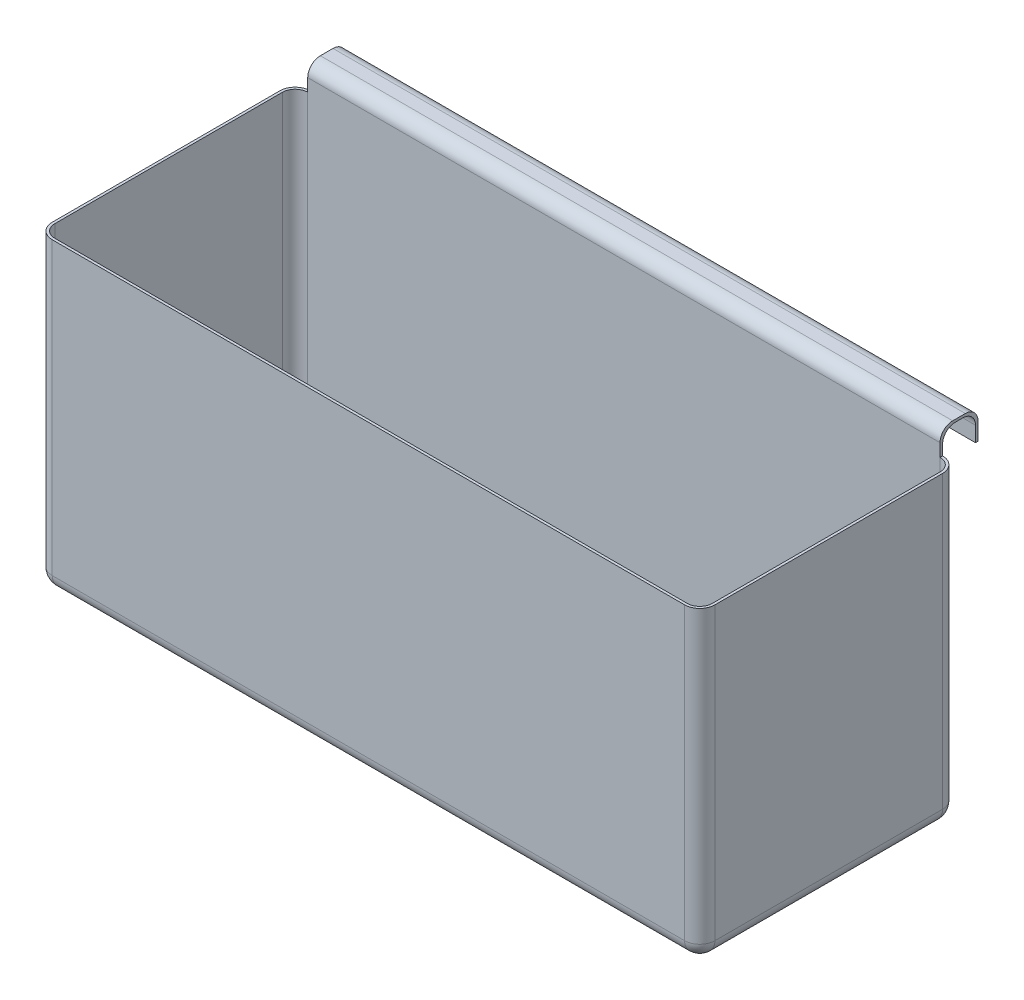
from build123d import *

# Parameters (mm, degrees)
SKETCH1_W           = 260
SKETCH1_H           = 100
BOSS_EXTRUDE1_DEPTH = 120
FILLET1_R           = 5
SHELL1_T            = 1


with BuildPart() as part:
    # Sketch1 → Boss-Extrude1 (new body)
    with BuildSketch(Plane(origin=(0, 0, 0), x_dir=(1, 0, 0), z_dir=(0, 1, 0))):
        Rectangle(SKETCH1_W, SKETCH1_H)
    extrude(amount=-BOSS_EXTRUDE1_DEPTH)

    # Fillet1
    fillet1_edges = [part.edges().sort_by_distance(p)[0] for p in [
        (130, -120, 0),
        (0, -120, -50),
        (-130, -120, 0),
        (-130, -60, -50),
        (130, -60, -50),
        (130, -60, 50),
        (-130, -60, 50),
        (0, -120, 50),
    ]]
    fillet(fillet1_edges, radius=FILLET1_R)

    # Shell1
    shell1_openings = [part.faces().sort_by_distance(p)[0] for p in [
        (0, 0, 0),
    ]]
    offset(amount=SHELL1_T, openings=shell1_openings, kind=Kind.INTERSECTION)

    # Sweep1: sweep along a path in Sketch3
    with BuildLine(Plane(origin=(0, 0, 0), x_dir=(1, 0, 0), z_dir=(0, 1, 0))) as sweep1_path:
        Line((-125, 51), (125, 51))
    # Sketch2 → Sweep1 (sweep)
    with BuildSketch(Plane(origin=(0, 0, 0), x_dir=(0, 0, -1), z_dir=(1, 0, 0))):
        with BuildLine():
            Line((51, 0), (51, 4))
            ThreePointArc((51, 4), (52.464466094, 7.535533906), (56, 9))
            Line((56, 9), (59, 9))
            ThreePointArc((59, 9), (62.535533906, 7.535533906), (64, 4))
            Line((64, 4), (64, -2))
            Line((64, -2), (65, -2))
            Line((65, -2), (65, 5))
            ThreePointArc((65, 5), (63.535533906, 8.535533906), (60, 10))
            Line((60, 10), (55, 10))
            ThreePointArc((55, 10), (51.464466094, 8.535533906), (50, 5))
            Line((50, 5), (50, 0))
            Line((50, 0), (51, 0))
        make_face()
    sweep(path=sweep1_path.line)


solid = part.part
